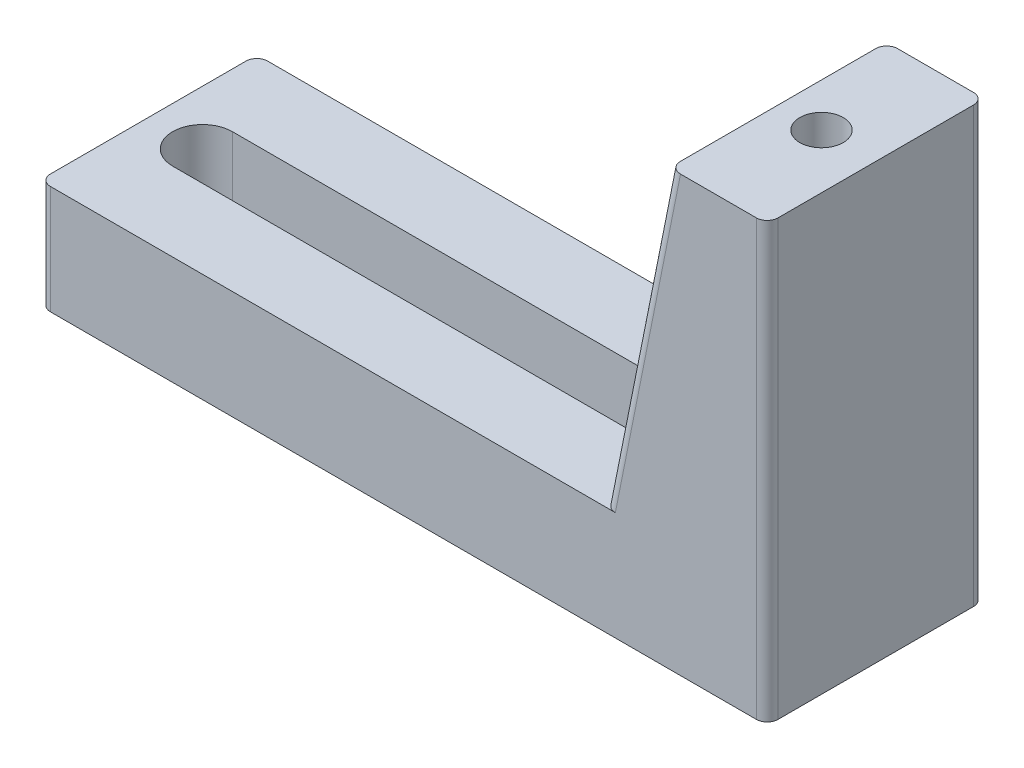
from build123d import *

# Parameters (mm, degrees)
EXTRUDE_1_DEPTH     = 20
SKETCH_2_R          = 2
SKETCH_2_R_2        = 2.75
CUT_EXTRUDE_1_DEPTH = 75.833147735
EXTRUDE_START       = -35
SKETCH_3_R          = 2
EXTRUDE_2_DEPTH     = 35
SKETCH_4_W          = 7
SKETCH_4_H          = 20
EXTRUDE_3_DEPTH     = 10
FILLET_2_R          = 1
CUT_EXTRUDE_2_DEPTH = 71


with BuildPart() as part:
    # ｽｹｯﾁ1 → ﾎﾞｽ - 押し出し1 (new body)
    with BuildSketch(Plane.XY):
        Polygon((0, 0), (45, 0), (51, 30), (60, 30), (60, -10), (0, -10), align=None)
    extrude(amount=EXTRUDE_1_DEPTH)

    # ｽｹｯﾁ2 → ｶｯﾄ - 押し出し1 (cut, through all)
    with BuildSketch(Plane(origin=(0, 30, 0), x_dir=(1, 0, 0), z_dir=(0, 1, 0))):
        with Locations(Location((55, -10, 0), (0, 0, 270))):
            Circle(SKETCH_2_R)
        with Locations(Location((3, -10, 0), (0, 0, 270))):
            Circle(SKETCH_2_R_2)
    extrude(amount=-CUT_EXTRUDE_1_DEPTH, mode=Mode.SUBTRACT)

    # ｽｹｯﾁ3 → ﾎﾞｽ - 押し出し2 (add)
    with BuildSketch(Plane.XZ.offset(10).offset(EXTRUDE_START)):
        with Locations(Location((55, 10, 0), (0, 0, 90))):
            Circle(SKETCH_3_R)
    extrude(amount=EXTRUDE_2_DEPTH)

    # ｽｹｯﾁ4 → ﾎﾞｽ - 押し出し3 (add)
    with BuildSketch(Plane(origin=(0, 0, 0), x_dir=(1, 0, 0), z_dir=(0, 1, 0))):
        with Locations((-3.5, -10)):
            Rectangle(SKETCH_4_W, SKETCH_4_H)
    extrude(amount=-EXTRUDE_3_DEPTH)

    # ﾌｨﾚｯﾄ2
    fillet_2_edges = [part.edges().sort_by_distance(p)[0] for p in [
        (60, 10, 20),
        (48, 15, 20),
        (-7, -5, 20),
        (-7, -5, 0),
        (48, 15, 0),
        (60, 10, 0),
    ]]
    fillet(fillet_2_edges, radius=FILLET_2_R)

    # ｽｹｯﾁ5 → ｶｯﾄ - 押し出し2 (cut, through all)
    with BuildSketch(Plane(origin=(0, 0, 0), x_dir=(1, 0, 0), z_dir=(0, 1, 0))):
        with BuildLine():
            Line((-2, -7.25), (40, -7.25))
            ThreePointArc((40, -7.25), (42.75, -10), (40, -12.75))
            Line((40, -12.75), (-2, -12.75))
            ThreePointArc((-2, -12.75), (-4.75, -10), (-2, -7.25))
        make_face()
    extrude(amount=-CUT_EXTRUDE_2_DEPTH, mode=Mode.SUBTRACT)


solid = part.part
